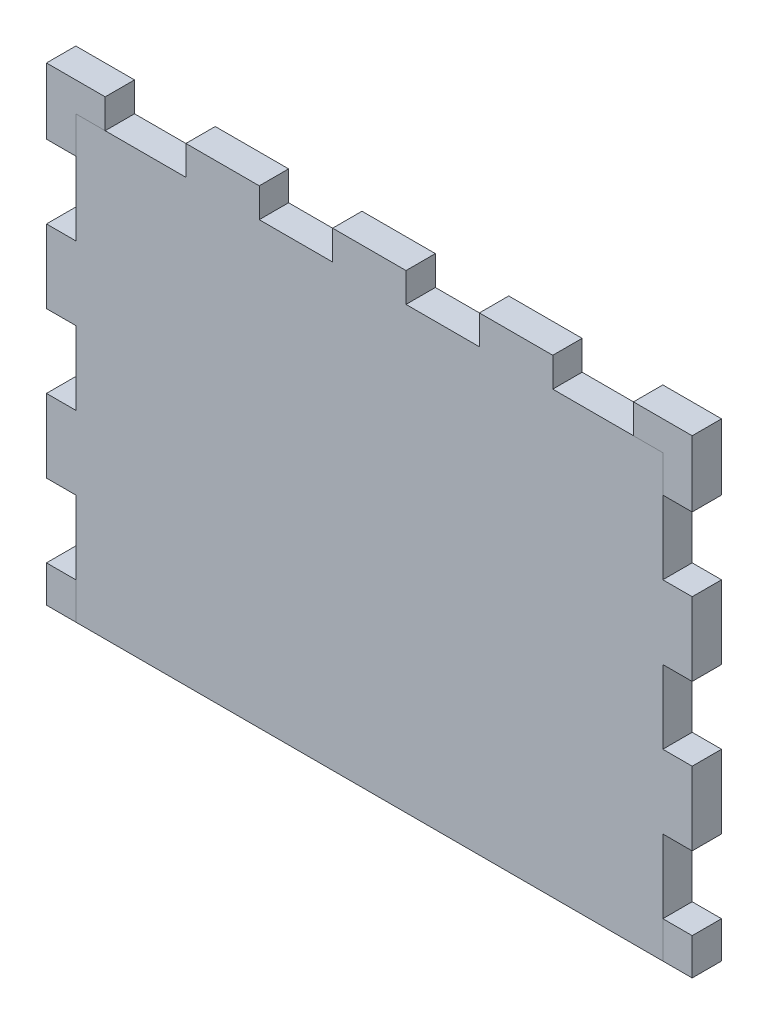
from build123d import *

# Parameters (mm, degrees)
SKETCH1_W             = 4
SKETCH1_H             = 5
BOSS_EXTRUDE1_DEPTH   = 4
BOSS_EXTRUDE2_DEPTH   = 4
BOSS_EXTRUDE2_2_DEPTH = 4
SKETCH2_W             = 4
SKETCH2_H             = 5
BOSS_EXTRUDE2_3_DEPTH = 4
BOSS_EXTRUDE2_4_DEPTH = 4


with BuildPart() as part:
    # Sketch1 → Boss-Extrude1 (new body)
    with BuildSketch(Plane.XY):
        Polygon((-25, 30), (-36, 30), (-36, 25), (-40, 25), (-40, 15), (-36, 15), (-36, 5), (-40, 5), (-40, -5), (-36, -5), (-36, -15), (-40, -15), (-40, -25), (-36, -25), (-36, -30), (36, -30), (36, -25), (40, -25), (40, -15), (36, -15), (36, -5), (40, -5), (40, 5), (36, 5), (36, 15), (40, 15), (40, 25), (36, 25), (36, 30), (25, 30), (25, 26), (15, 26), (15, 30), (5, 30), (5, 26), (-5, 26), (-5, 30), (-15, 30), (-15, 26), (-25, 26), align=None)
        Polygon((-36, 15), (-40, 15), (-40, 10), (-40, 5), (-36, 5), align=None)
        Polygon((-40, 10), (-40, 15), (-44, 15), (-44, 5), (-40, 5), align=None)
        Polygon((-36, -5), (-40, -5), (-40, -10), (-40, -15), (-36, -15), align=None)
        Polygon((-40, -10), (-40, -5), (-44, -5), (-44, -15), (-40, -15), align=None)
        with Locations((-38, -27.5)):
            Rectangle(SKETCH1_W, SKETCH1_H)
        with Locations((38, -27.5)):
            Rectangle(SKETCH1_W, SKETCH1_H)
        Polygon((36, -15), (40, -15), (40, -10), (40, -5), (36, -5), align=None)
        Polygon((40, -10), (40, -15), (44, -15), (44, -5), (40, -5), align=None)
        Polygon((40, 10), (40, 15), (36, 15), (36, 5), (40, 5), align=None)
        Polygon((44, 15), (40, 15), (40, 10), (40, 5), (44, 5), align=None)
        with Locations((38, 27.5)):
            Rectangle(SKETCH1_W, SKETCH1_H)
        Polygon((20, 30), (15, 30), (15, 26), (25, 26), (25, 30), align=None)
        Polygon((15, 34), (15, 30), (20, 30), (25, 30), (25, 34), align=None)
        Polygon((0, 30), (-5, 30), (-5, 26), (5, 26), (5, 30), align=None)
        Polygon((-5, 34), (-5, 30), (0, 30), (5, 30), (5, 34), align=None)
        with Locations((-38, 27.5)):
            Rectangle(SKETCH1_W, SKETCH1_H)
        Polygon((-20, 30), (-25, 30), (-25, 26), (-15, 26), (-15, 30), align=None)
        Polygon((-25, 34), (-25, 30), (-20, 30), (-15, 30), (-15, 34), align=None)
    extrude(amount=BOSS_EXTRUDE1_DEPTH)


with BuildPart() as body_2:
    # Sketch2 → Boss-Extrude2 (new body)
    with BuildSketch(Plane.XY.offset(4)):
        Polygon((-44, 34), (-44, 25), (-40, 25), (-40, 30), (-36, 30), (-36, 34), align=None)
    extrude(amount=-BOSS_EXTRUDE2_DEPTH)


with BuildPart() as body_3:
    # Sketch2 → Boss-Extrude2 2 (new body)
    with BuildSketch(Plane.XY.offset(4)):
        Polygon((40, 30), (40, 25), (44, 25), (44, 34), (36, 34), (36, 30), align=None)
    extrude(amount=-BOSS_EXTRUDE2_2_DEPTH)


with BuildPart() as body_4:
    # Sketch2 → Boss-Extrude2 3 (new body)
    with BuildSketch(Plane.XY.offset(4)):
        with Locations((42, -27.5)):
            Rectangle(SKETCH2_W, SKETCH2_H)
    extrude(amount=-BOSS_EXTRUDE2_3_DEPTH)


with BuildPart() as body_5:
    # Sketch2 → Boss-Extrude2 4 (new body)
    with BuildSketch(Plane.XY.offset(4)):
        with Locations((-42, -27.5)):
            Rectangle(SKETCH2_W, SKETCH2_H)
    extrude(amount=-BOSS_EXTRUDE2_4_DEPTH)


solid = Compound([part.part, body_2.part, body_3.part, body_4.part, body_5.part])
